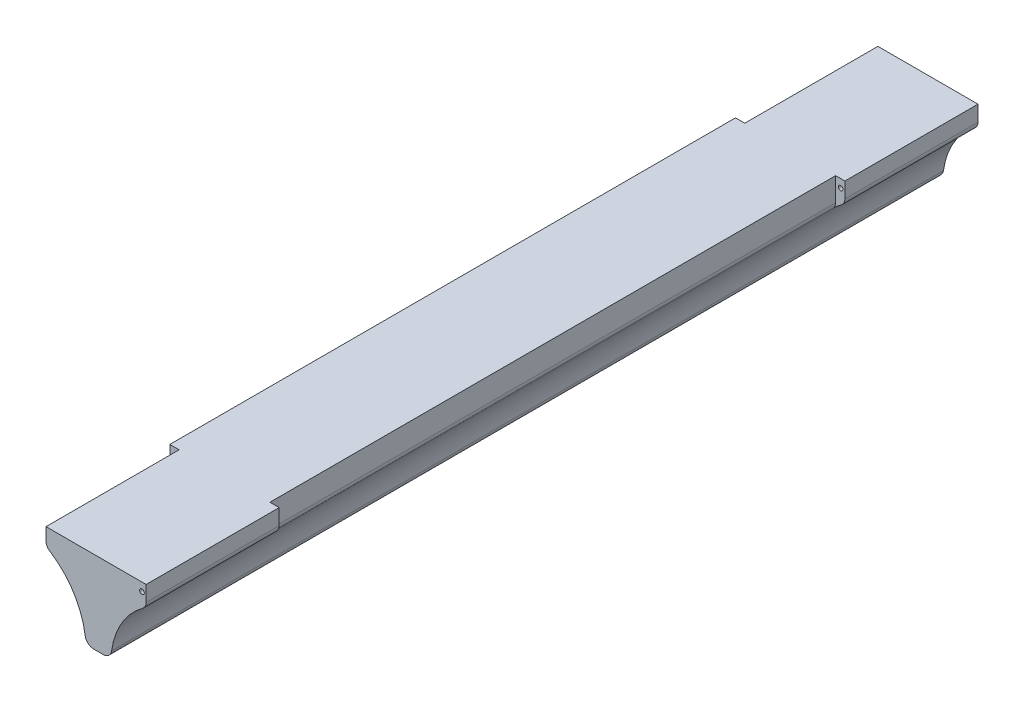
from build123d import *

# Parameters (mm, degrees)
BOSS_EXTRUDE1_DEPTH     = 25
CUT_EXTRUDE6_DEPTH      = 17
CUT_EXTRUDE6_DEPTH_BACK = 17
SKETCH9_W               = 0.558111167
SKETCH9_H               = 1.818787441
CUT_EXTRUDE7_START      = -8
SKETCH11_R              = 0.139327756
SKETCH11_R_2            = 0.125822814
CUT_EXTRUDE7_DEPTH      = 8
SKETCH13_R              = 0.125822814
CUT_EXTRUDE12_DEPTH     = 1
FILLET3_R               = 0.5


with BuildPart() as part:
    # Sketch1 → Boss-Extrude1 (new, symmetric)
    with BuildSketch(Plane.XY):
        with BuildLine():
            Line((2.869208069, 3.068545431), (-3.706559837, 3.068545431))
            Line((-3.706559837, 3.068545431), (-3.706559837, 2.312213583))
            ThreePointArc((-3.706559837, 2.312213583), (-1.749706829, 0.836593392), (-0.796044874, -1.421117289))
            ThreePointArc((-0.796044874, -1.421117289), (-0.61902671, -1.745895622), (-0.271314784, -1.872041617))
            ThreePointArc((-0.271314784, -1.872041617), (0, -1.870162722), (0.271314784, -1.872041617))
            ThreePointArc((0.271314784, -1.872041617), (0.61902671, -1.745895622), (0.796044874, -1.421117289))
            ThreePointArc((0.796044874, -1.421117289), (1.477625841, 0.448969612), (2.869208069, 1.872091721))
            Line((2.869208069, 1.872091721), (2.869208069, 3.068545431))
        make_face()
    extrude(amount=BOSS_EXTRUDE1_DEPTH, both=True)

    # Sketch9 → Cut-Extrude6 (cut, two sides: drawn at the far end of the back side and taken through both)
    with BuildSketch(Plane.XY.offset(-CUT_EXTRUDE6_DEPTH_BACK)):
        with Locations((2.590152485, 2.15915171)):
            Rectangle(SKETCH9_W, SKETCH9_H)
    extrude(amount=CUT_EXTRUDE6_DEPTH + CUT_EXTRUDE6_DEPTH_BACK, mode=Mode.SUBTRACT)

    # Sketch11 → Cut-Extrude7 (cut)
    # profile 1 of 2: a face of its own
    with BuildSketch(Plane(origin=(0, 0, 17), x_dir=(-1, 0, 0), z_dir=(0, 0, -1)).offset(CUT_EXTRUDE7_START)):
        with Locations((-2.619208069, 2.568545431)):
            Circle(SKETCH11_R)
    # profile 2 of 2: a face of its own
    with BuildSketch(Plane(origin=(0, 0, 17), x_dir=(-1, 0, 0), z_dir=(0, 0, -1)).offset(CUT_EXTRUDE7_START)):
        with BuildLine():
            Line((3.706559837, 3.068545431), (3.706559837, 2.312213583))
            ThreePointArc((3.706559837, 2.312213583), (3.423086279, 2.186837068), (3.14844867, 2.043133511))
            Line((3.14844867, 2.043133511), (3.14844867, 3.068545431))
            Line((3.14844867, 3.068545431), (3.706559837, 3.068545431))
        make_face()
        with Locations((3.438785788, 2.465008687)):
            Circle(SKETCH11_R_2, mode=Mode.SUBTRACT)
    cut_extrude7 = extrude(amount=CUT_EXTRUDE7_DEPTH, mode=Mode.SUBTRACT)

    # Sketch13 → Cut-Extrude12 (cut)
    with BuildSketch(Plane.XY.offset(25)):
        with Locations(Location((-3.438785788, 2.465008687, 0), (0, 0, 180))):
            Circle(SKETCH13_R)
    cut_extrude12 = extrude(amount=-CUT_EXTRUDE12_DEPTH, mode=Mode.SUBTRACT)

    # Mirror1: Cut-Extrude7, Cut-Extrude12 across plane
    add(cut_extrude7.mirror(Plane.XY), mode=Mode.SUBTRACT)
    add(cut_extrude12.mirror(Plane.XY), mode=Mode.SUBTRACT)

    # Fillet3
    fillet3_edges = [part.edges().sort_by_distance(p)[0] for p in [
        (-3.14844867, 2.043133511, -21),
        (2.869208069, 1.872091721, 21),
        (2.869208069, 1.872091721, -21),
        (2.311096902, 1.439762425, 0),
        (-3.706559837, 2.312213583, 0),
        (-3.14844867, 2.043133511, 21),
    ]]
    fillet(fillet3_edges, radius=FILLET3_R)


solid = part.part
